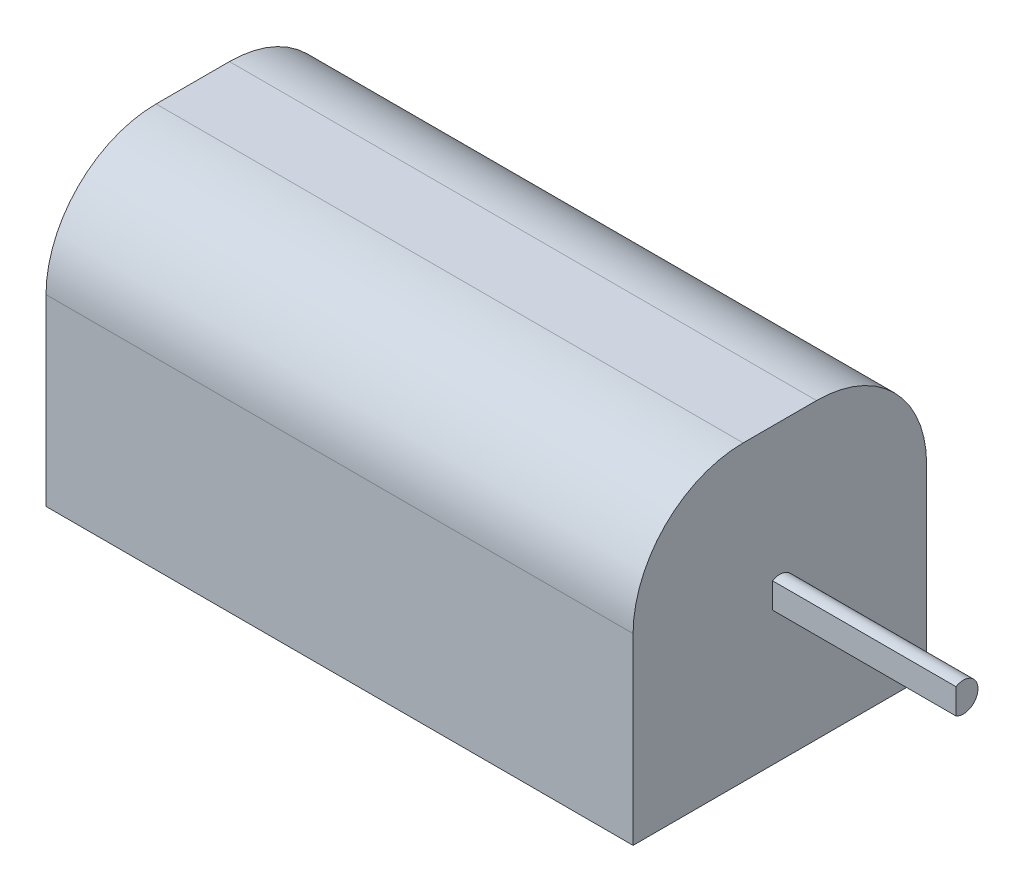
from build123d import *

# Parameters (mm, degrees)
SKETCH1_W           = 80
SKETCH1_H           = 40
BOSS_EXTRUDE1_DEPTH = 20
BOSS_EXTRUDE2_START = 40
BOSS_EXTRUDE2_DEPTH = 25
FILLET1_R           = 15


with BuildPart() as part:
    # Sketch1 → Boss-Extrude1 (new, symmetric)
    with BuildSketch(Plane(origin=(0, 0, 0), x_dir=(1, 0, 0), z_dir=(0, 1, 0))):
        Rectangle(SKETCH1_W, SKETCH1_H)
    extrude(amount=BOSS_EXTRUDE1_DEPTH, both=True)

    # Sketch4 → Boss-Extrude2 (add)
    with BuildSketch(Plane(origin=(0, 0, 0), x_dir=(0, 0, -1), z_dir=(1, 0, 0)).offset(BOSS_EXTRUDE2_START)):
        with BuildLine():
            ThreePointArc((2, 0), (1, 1.732050808), (-1, 1.732050808))
            Line((-1, 1.732050808), (-1, -1.732050808))
            ThreePointArc((-1, -1.732050808), (1, -1.732050808), (2, 0))
        make_face()
    extrude(amount=BOSS_EXTRUDE2_DEPTH)

    # Fillet1
    fillet1_edges = [part.edges().sort_by_distance(p)[0] for p in [
        (0, 20, 20),
        (0, 20, -20),
    ]]
    fillet(fillet1_edges, radius=FILLET1_R)


solid = part.part
